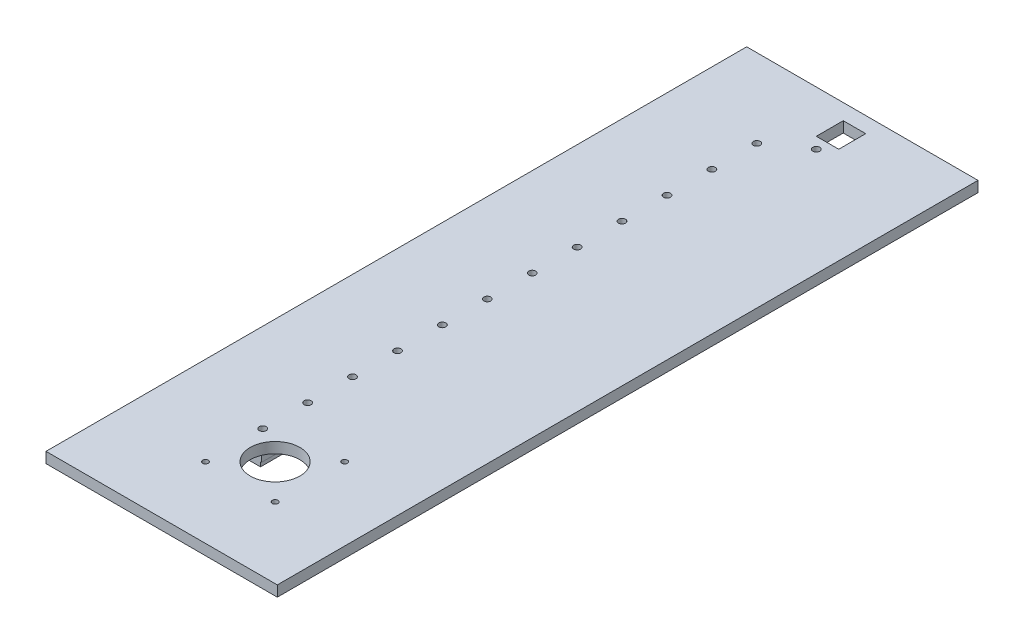
from build123d import *

# Parameters (mm, degrees)
BOSS_EXTRUDE2_DEPTH = 230
SKETCH2_R           = 3
CUT_EXTRUDE1_DEPTH  = 4
SKETCH3_R           = 1.55
CUT_EXTRUDE2_DEPTH  = 4
LPATTERN1_COUNT     = 12
LPATTERN1_PITCH     = 20
SKETCH4_W           = 103
SKETCH4_H           = 312
SKETCH4_R           = 11.05
SKETCH4_R_2         = 1.55
SKETCH4_W_2         = 10
SKETCH4_H_2         = 12
BOSS_EXTRUDE3_DEPTH = 4.75
SKETCH5_R           = 1.25
CUT_EXTRUDE3_DEPTH  = 10


with BuildPart() as part:
    # Sketch1 → Boss-Extrude2 (new body)
    with BuildSketch(Plane.XY):
        Polygon((0.5, 2), (0.5, 0), (8.5, 0), (8.5, 2), (9, 2), (9, 5.5), (0, 5.5), (0, 2), align=None)
    extrude(amount=BOSS_EXTRUDE2_DEPTH)

    # Sketch2 → Cut-Extrude1 (cut)
    with BuildSketch(Plane(origin=(0, 0, 0), x_dir=(-1, 0, 0), z_dir=(0, -1, 0))):
        with Locations(Location((-4.5, -225, 0), (0, 0, 90))):
            Circle(SKETCH2_R)
    cut_extrude1 = extrude(amount=-CUT_EXTRUDE1_DEPTH, mode=Mode.SUBTRACT)

    # Sketch3 → Cut-Extrude2 (cut)
    with BuildSketch(Plane(origin=(0, 4, 0), x_dir=(-1, 0, 0), z_dir=(0, -1, 0))):
        with Locations(Location((-4.5, -225, 0), (0, 0, 90))):
            Circle(SKETCH3_R)
    cut_extrude2 = extrude(amount=-CUT_EXTRUDE2_DEPTH, mode=Mode.SUBTRACT)

    # LPattern1: Cut-Extrude1, Cut-Extrude2 ×12
    with Locations(*[(0, 0, -i * LPATTERN1_PITCH) for i in range(1, LPATTERN1_COUNT)]):
        add(cut_extrude1, mode=Mode.SUBTRACT)
        add(cut_extrude2, mode=Mode.SUBTRACT)

    # Sketch4 → Boss-Extrude3 (add)
    with BuildSketch(Plane(origin=(0, 5.5, 0), x_dir=(1, 0, 0), z_dir=(0, 1, 0))):
        with Locations((16.5, -126)):
            Rectangle(SKETCH4_W, SKETCH4_H)
        with Locations(Location((20, -235, 0), (0, 0, 270))):
            Circle(SKETCH4_R, mode=Mode.SUBTRACT)
        with Locations(Location((20, 6, 0), (0, 0, 270))):
            Circle(SKETCH4_R_2, mode=Mode.SUBTRACT)
        with Locations(Location((4.5, -225, 0), (0, 0, 90))):
            Circle(SKETCH4_R_2, mode=Mode.SUBTRACT)
        with Locations(Location((4.5, -205, 0), (0, 0, 90))):
            Circle(SKETCH4_R_2, mode=Mode.SUBTRACT)
        with Locations(Location((4.5, -185, 0), (0, 0, 90))):
            Circle(SKETCH4_R_2, mode=Mode.SUBTRACT)
        with Locations(Location((4.5, -165, 0), (0, 0, 90))):
            Circle(SKETCH4_R_2, mode=Mode.SUBTRACT)
        with Locations(Location((4.5, -145, 0), (0, 0, 90))):
            Circle(SKETCH4_R_2, mode=Mode.SUBTRACT)
        with Locations(Location((4.5, -125, 0), (0, 0, 90))):
            Circle(SKETCH4_R_2, mode=Mode.SUBTRACT)
        with Locations(Location((4.5, -105, 0), (0, 0, 90))):
            Circle(SKETCH4_R_2, mode=Mode.SUBTRACT)
        with Locations(Location((4.5, -85, 0), (0, 0, 90))):
            Circle(SKETCH4_R_2, mode=Mode.SUBTRACT)
        with Locations(Location((4.5, -65, 0), (0, 0, 90))):
            Circle(SKETCH4_R_2, mode=Mode.SUBTRACT)
        with Locations(Location((4.5, -45, 0), (0, 0, 90))):
            Circle(SKETCH4_R_2, mode=Mode.SUBTRACT)
        with Locations(Location((4.5, -25, 0), (0, 0, 90))):
            Circle(SKETCH4_R_2, mode=Mode.SUBTRACT)
        with Locations(Location((4.5, -5, 0), (0, 0, 90))):
            Circle(SKETCH4_R_2, mode=Mode.SUBTRACT)
        with Locations((20, 17)):
            Rectangle(SKETCH4_W_2, SKETCH4_H_2, mode=Mode.SUBTRACT)
    extrude(amount=BOSS_EXTRUDE3_DEPTH)

    # Sketch5 → Cut-Extrude3 (cut)
    with BuildSketch(Plane(origin=(0, 10.25, 0), x_dir=(1, 0, 0), z_dir=(0, 1, 0))):
        with Locations(Location((35.5, -250.5, 0), (0, 0, 270))):
            Circle(SKETCH5_R)
        with Locations(Location((4.5, -250.5, 0), (0, 0, 270))):
            Circle(SKETCH5_R)
        with Locations(Location((35.5, -219.5, 0), (0, 0, 270))):
            Circle(SKETCH5_R)
    extrude(amount=-CUT_EXTRUDE3_DEPTH, mode=Mode.SUBTRACT)


solid = part.part
